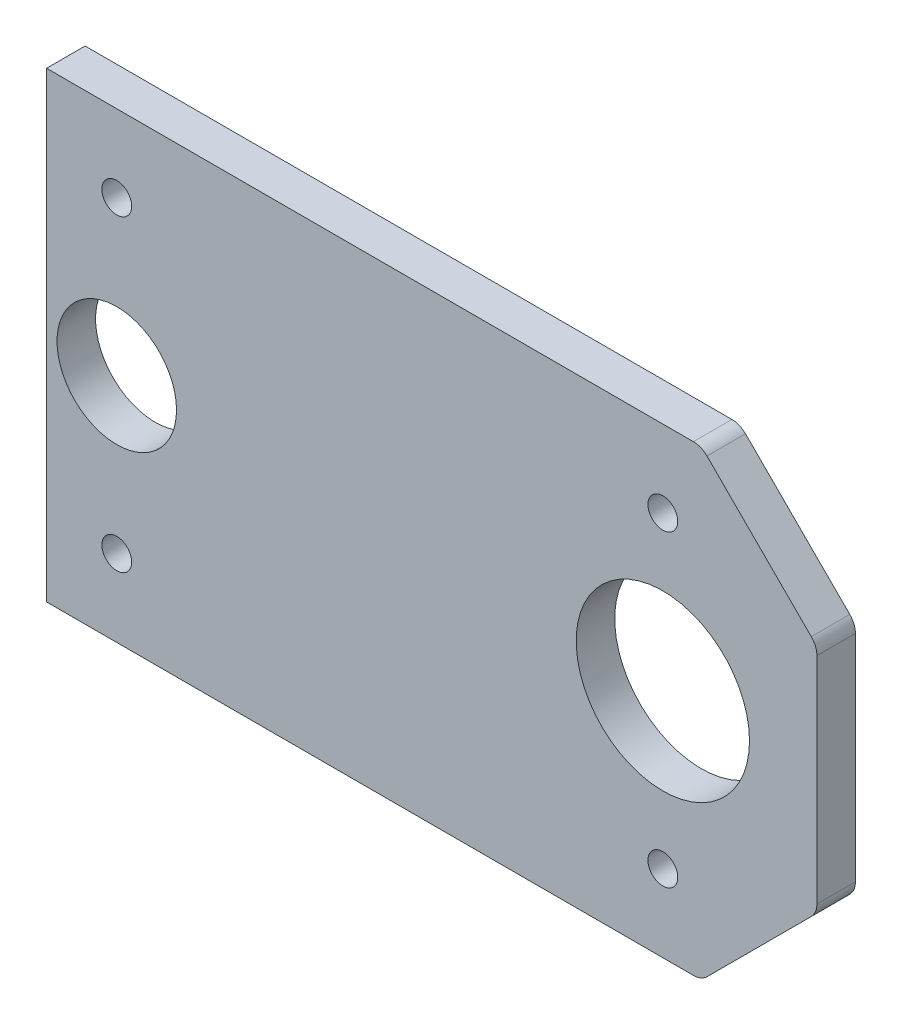
from build123d import *

# Parameters (mm, degrees)
SKETCH1_W                    = 127
SKETCH1_H                    = 76.2
BOSS_EXTRUDE1_DEPTH          = 3.175
SKETCH2_R                    = 9.84885
SKETCH2_R_2                  = 14.2875
CUT_EXTRUDE1_DEPTH           = 75.324844433
CHAMFER1_SIZE                = 19.05
F_10_0_1935_DIAMETER_HOLE1_D = 4.9149
FILLET1_R                    = 3.175


with BuildPart() as part:
    # Sketch1 → Boss-Extrude1 (new, symmetric)
    with BuildSketch(Plane.XY):
        Rectangle(SKETCH1_W, SKETCH1_H)
    extrude(amount=BOSS_EXTRUDE1_DEPTH, both=True)

    # Sketch2 → Cut-Extrude1 (cut, through all)
    with BuildSketch(Plane.XY.offset(3.175)):
        with Locations((-51.92522, 0)):
            Circle(SKETCH2_R)
        with Locations((38.1, 0)):
            Circle(SKETCH2_R_2)
    extrude(amount=-CUT_EXTRUDE1_DEPTH, mode=Mode.SUBTRACT)

    # Chamfer1
    chamfer1_edges = [part.edges().sort_by_distance(p)[0] for p in [
        (63.5, -38.1, 0),
        (63.5, 38.1, 0),
    ]]
    chamfer(chamfer1_edges, length=CHAMFER1_SIZE)

    # #10 (0.1935) Diameter Hole1 (through all)
    with Locations(Plane.XY.offset(3.175)):
        with Locations((-51.92522, 25.4), (-51.92522, -25.4), (38.1, 25.4), (38.1, -25.4), (-51.92522, 0), (38.1, 0)):
            Hole(F_10_0_1935_DIAMETER_HOLE1_D / 2)

    # Fillet1
    fillet1_edges = [part.edges().sort_by_distance(p)[0] for p in [
        (44.45, 38.1, 0),
        (63.5, -19.05, 0),
        (63.5, 19.05, 0),
        (44.45, -38.1, 0),
    ]]
    fillet(fillet1_edges, radius=FILLET1_R)


solid = part.part
